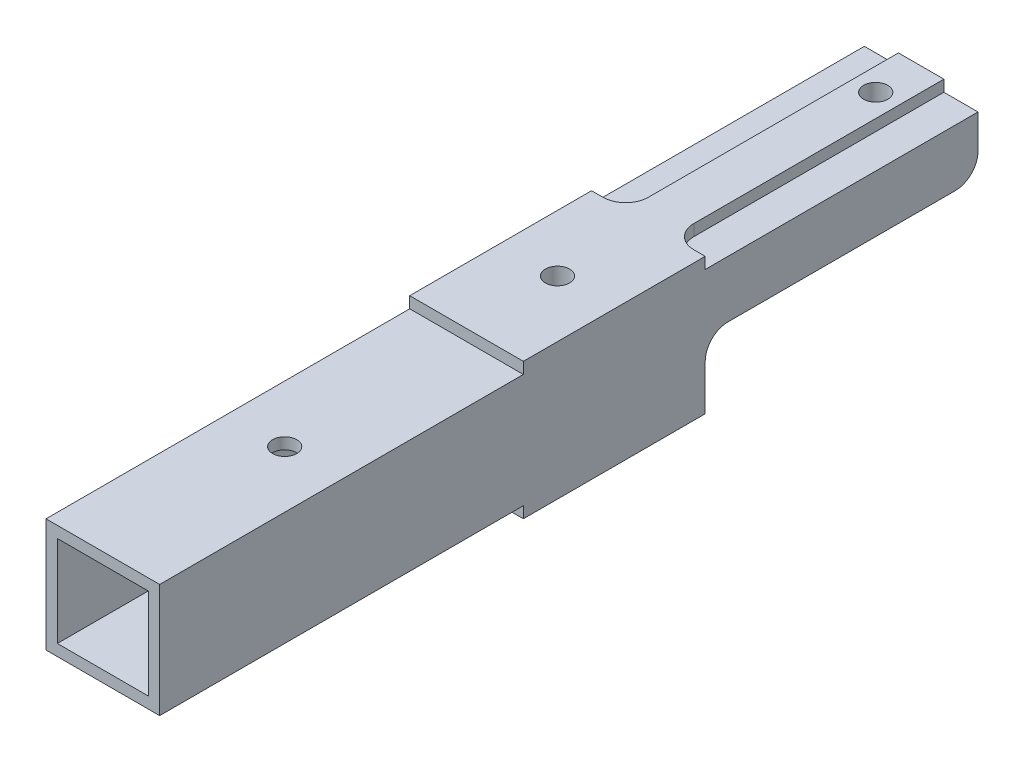
from build123d import *

# Parameters (mm, degrees)
SKETCH1_W               = 38.1
SKETCH1_H               = 38.1
SKETCH1_W_2             = 25.4
SKETCH1_H_2             = 25.4
EXTRUDE1_DEPTH          = 228.6
F_1_4_CLEARANCE_HOLE1_D = 6.7564
SKETCH4_W               = 12.7
SKETCH4_H               = 76.2
SKETCH4_W_2             = 38.1
SKETCH4_H_2             = 101.6
EXTRUDE2_DEPTH          = 3.175
SKETCH5_W               = 228.6
SKETCH5_H               = 38.1
EXTRUDE3_DEPTH          = 3.175
FILLET2_R               = 6.35
SKETCH8_W               = 76.2
SKETCH8_H               = 19.05
EXTRUDE6_DEPTH          = 232.579198116
FILLET3_R               = 6.35
FILLET4_R               = 6.35


with BuildPart() as part:
    # Sketch1 → Extrude1 (new body)
    with BuildSketch(Plane.XY):
        Rectangle(SKETCH1_W, SKETCH1_H)
        Rectangle(SKETCH1_W_2, SKETCH1_H_2, mode=Mode.SUBTRACT)
    extrude(amount=-EXTRUDE1_DEPTH)

    # 1/4 Clearance Hole1 (through all)
    with Locations(Plane(origin=(0, 19.05, 0), x_dir=(-1, 0, 0), z_dir=(0, 1, 0))):
        with Locations((0, -215.9), (0, -50.8), (0, -127)):
            Hole(F_1_4_CLEARANCE_HOLE1_D / 2)

    # Sketch4 → Extrude2 (cut)
    with BuildSketch(Plane(origin=(0, 19.05, 0), x_dir=(1, 0, 0), z_dir=(0, 1, 0))):
        with Locations((-12.7, 190.5)):
            Rectangle(SKETCH4_W, SKETCH4_H)
        with Locations((0, 50.8)):
            Rectangle(SKETCH4_W_2, SKETCH4_H_2)
        with Locations((12.7, 190.5)):
            Rectangle(SKETCH4_W, SKETCH4_H)
    extrude2 = extrude(amount=-EXTRUDE2_DEPTH, mode=Mode.SUBTRACT)

    # Mirror1: Extrude2 across plane
    add(extrude2.mirror(Plane.ZX), mode=Mode.SUBTRACT)

    # Sketch5 → Extrude3 (cut)
    with BuildSketch(Plane(origin=(19.05, 0, 0), x_dir=(0, 0, -1), z_dir=(1, 0, 0))):
        with Locations((114.3, 0)):
            Rectangle(SKETCH5_W, SKETCH5_H)
    extrude3 = extrude(amount=-EXTRUDE3_DEPTH, mode=Mode.SUBTRACT)

    # Mirror2: Extrude3 across plane
    add(extrude3.mirror(Plane(origin=(0, 0, 0), x_dir=(0, 0, 1), z_dir=(1, 0, 0))), mode=Mode.SUBTRACT)

    # Fillet2
    fillet2_edges = [part.edges().sort_by_distance(p)[0] for p in [
        (-6.35, 17.4625, -152.4),
        (6.35, 17.4625, -152.4),
    ]]
    fillet(fillet2_edges, radius=FILLET2_R)

    # Sketch8 → Extrude6 (cut, through all)
    with BuildSketch(Plane(origin=(15.875, 0, 0), x_dir=(0, 0, -1), z_dir=(1, 0, 0))):
        with Locations((190.5, -9.525)):
            Rectangle(SKETCH8_W, SKETCH8_H)
    extrude(amount=-EXTRUDE6_DEPTH, mode=Mode.SUBTRACT)

    # Fillet3
    fillet3_edges = [part.edges().sort_by_distance(p)[0] for p in [
        (-14.2875, 0, -152.4),
        (14.2875, 0, -152.4),
    ]]
    fillet(fillet3_edges, radius=FILLET3_R)

    # Fillet4
    fillet4_edges = [part.edges().sort_by_distance(p)[0] for p in [
        (-14.2875, 0, -228.6),
        (14.2875, 0, -228.6),
    ]]
    fillet(fillet4_edges, radius=FILLET4_R)


solid = part.part
